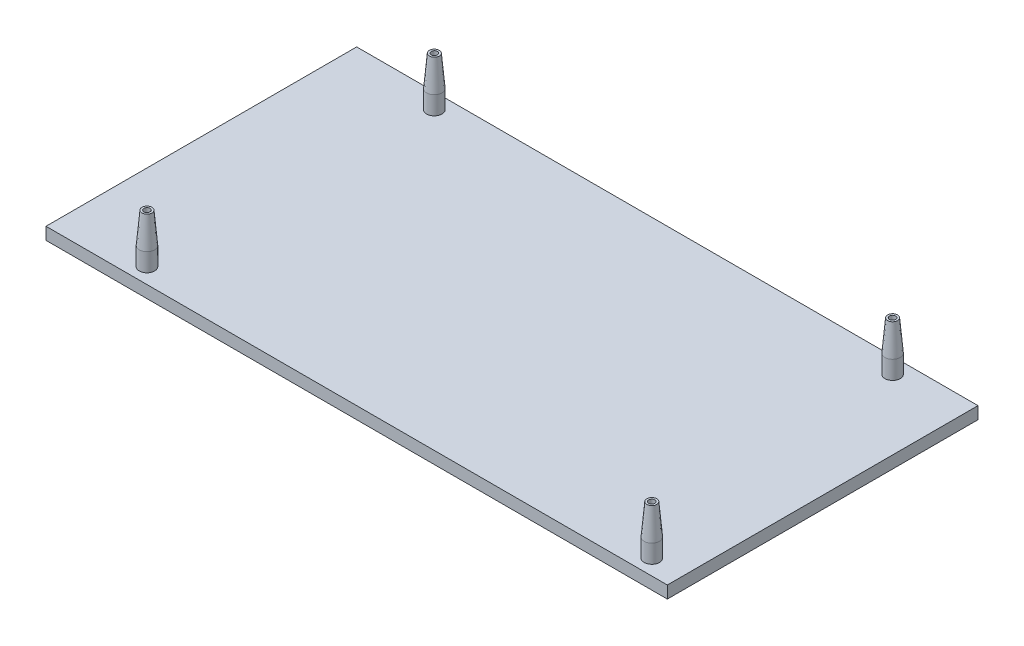
from build123d import *
from OCP.BRepFilletAPI import BRepFilletAPI_MakeChamfer

# Parameters (mm, degrees)
SKETCH1_W           = 101.6
SKETCH1_H           = 50.8
SKETCH1_R           = 0.5
BOSS_EXTRUDE1_DEPTH = 2
SKETCH2_R           = 1.25
SKETCH2_R_2         = 0.5
BOSS_EXTRUDE2_DEPTH = 8
CHAMFER1_SIZE       = 5
CHAMFER1_SIZE2      = 0.437443318


with BuildPart() as part:
    # Sketch1 → Boss-Extrude1 (new body)
    with BuildSketch(Plane(origin=(0, 0, 0), x_dir=(1, 0, 0), z_dir=(0, 1, 0))):
        with Locations((24.438845131, -1.159672083)):
            Rectangle(SKETCH1_W, SKETCH1_H)
        with Locations(Location((-11.121154869, 21.700327917, 0), (0, 0, 270))):
            Circle(SKETCH1_R, mode=Mode.SUBTRACT)
        with Locations(Location((-12.391154869, -24.019672083, 0), (0, 0, 270))):
            Circle(SKETCH1_R, mode=Mode.SUBTRACT)
        with Locations(Location((63.808845131, 21.700327917, 0), (0, 0, 270))):
            Circle(SKETCH1_R, mode=Mode.SUBTRACT)
        with Locations(Location((70.158845131, -24.019672083, 0), (0, 0, 270))):
            Circle(SKETCH1_R, mode=Mode.SUBTRACT)
    extrude(amount=BOSS_EXTRUDE1_DEPTH)

    # Sketch2 → Boss-Extrude2 (add)
    # profile 1 of 4: a face of its own
    with BuildSketch(Plane(origin=(0, 2, 0), x_dir=(1, 0, 0), z_dir=(0, 1, 0))):
        with Locations(Location((-11.121154869, 21.700327917, 0), (0, 0, 270))):
            Circle(SKETCH2_R)
        with Locations(Location((-11.121154869, 21.700327917, 0), (0, 0, 270))):
            Circle(SKETCH2_R_2, mode=Mode.SUBTRACT)
    # profile 2 of 4: a face of its own
    with BuildSketch(Plane(origin=(0, 2, 0), x_dir=(1, 0, 0), z_dir=(0, 1, 0))):
        with Locations(Location((-12.391154869, -24.019672083, 0), (0, 0, 270))):
            Circle(SKETCH2_R)
        with Locations(Location((-12.391154869, -24.019672083, 0), (0, 0, 270))):
            Circle(SKETCH2_R_2, mode=Mode.SUBTRACT)
    # profile 3 of 4: a face of its own
    with BuildSketch(Plane(origin=(0, 2, 0), x_dir=(1, 0, 0), z_dir=(0, 1, 0))):
        with Locations(Location((70.158845131, -24.019672083, 0), (0, 0, 270))):
            Circle(SKETCH2_R)
        with Locations(Location((70.158845131, -24.019672083, 0), (0, 0, 270))):
            Circle(SKETCH2_R_2, mode=Mode.SUBTRACT)
    # profile 4 of 4: a face of its own
    with BuildSketch(Plane(origin=(0, 2, 0), x_dir=(1, 0, 0), z_dir=(0, 1, 0))):
        with Locations(Location((63.808845131, 21.700327917, 0), (0, 0, 270))):
            Circle(SKETCH2_R)
        with Locations(Location((63.808845131, 21.700327917, 0), (0, 0, 270))):
            Circle(SKETCH2_R_2, mode=Mode.SUBTRACT)
    extrude(amount=BOSS_EXTRUDE2_DEPTH)

    # Chamfer1: one chamfer whose edges measure the first distance from different faces: ONE call of the kernel's chamfer builder (chamfer() names one face for all edges)
    chamfer1_edges_1 = [part.edges().sort_by_distance(p)[0] for p in [
        (-11.121154869, 10, -22.950327917),
    ]]
    chamfer1_side_1 = [part.faces().sort_by_distance(p)[0] for p in [
        (-11.121154869, 6, -22.950327917),
    ]]
    chamfer1_edges_2 = [part.edges().sort_by_distance(p)[0] for p in [
        (-12.391154869, 10, 22.769672083),
    ]]
    chamfer1_side_2 = [part.faces().sort_by_distance(p)[0] for p in [
        (-12.391154869, 6, 22.769672083),
    ]]
    chamfer1_edges_3 = [part.edges().sort_by_distance(p)[0] for p in [
        (70.158845131, 10, 22.769672083),
    ]]
    chamfer1_side_3 = [part.faces().sort_by_distance(p)[0] for p in [
        (70.158845131, 6, 22.769672083),
    ]]
    chamfer1_edges_4 = [part.edges().sort_by_distance(p)[0] for p in [
        (63.808845131, 10, -22.950327917),
    ]]
    chamfer1_side_4 = [part.faces().sort_by_distance(p)[0] for p in [
        (63.808845131, 6, -22.950327917),
    ]]
    chamfer1 = BRepFilletAPI_MakeChamfer(part.part.solid().wrapped)
    for e in chamfer1_edges_1:
        chamfer1.Add(CHAMFER1_SIZE, CHAMFER1_SIZE2, e.wrapped, chamfer1_side_1[0].wrapped)  # the first distance lies on this face
    for e in chamfer1_edges_2:
        chamfer1.Add(CHAMFER1_SIZE, CHAMFER1_SIZE2, e.wrapped, chamfer1_side_2[0].wrapped)  # the first distance lies on this face
    for e in chamfer1_edges_3:
        chamfer1.Add(CHAMFER1_SIZE, CHAMFER1_SIZE2, e.wrapped, chamfer1_side_3[0].wrapped)  # the first distance lies on this face
    for e in chamfer1_edges_4:
        chamfer1.Add(CHAMFER1_SIZE, CHAMFER1_SIZE2, e.wrapped, chamfer1_side_4[0].wrapped)  # the first distance lies on this face
    add(Compound.cast(chamfer1.Shape()), mode=Mode.REPLACE)


solid = part.part
